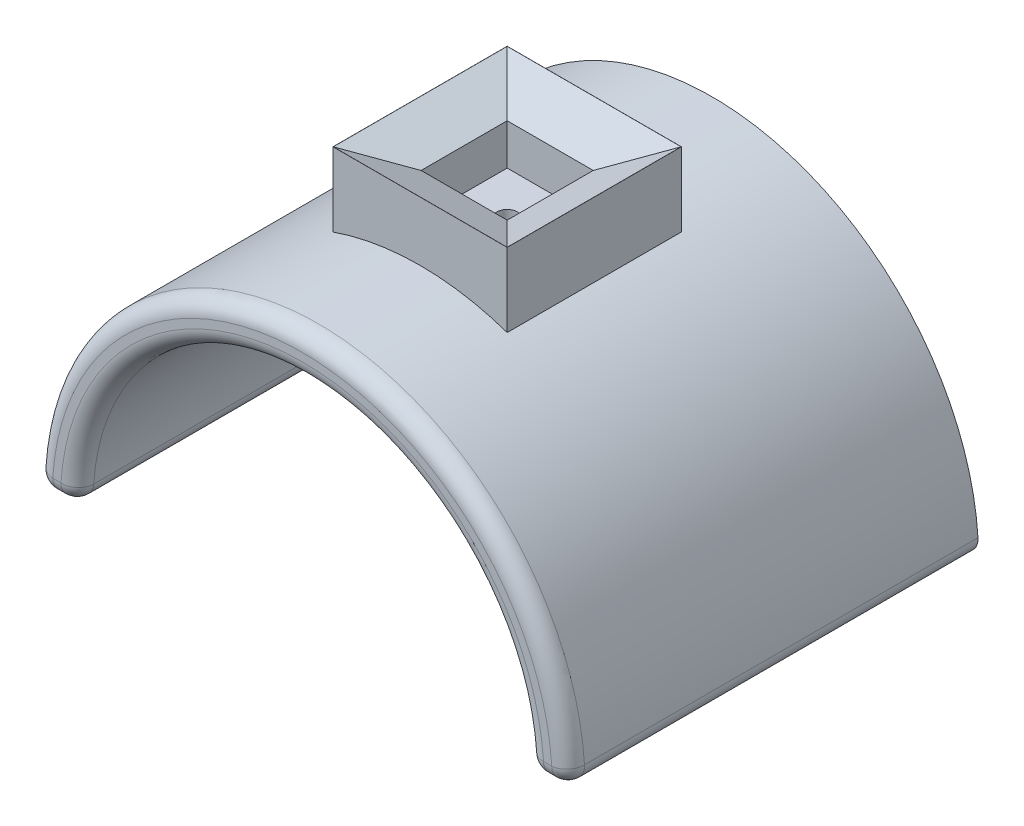
from build123d import *
from OCP.BRepFilletAPI import BRepFilletAPI_MakeChamfer

# Parameters (mm, degrees)
BOSS_EXTRUDE1_DEPTH = 50
BOSS_EXTRUDE2_DEPTH = 21.25
FILLET1_R           = 4
FILLET2_R           = 4
SKETCH3_W           = 21
SKETCH3_H           = 21
CUT_EXTRUDE1_DEPTH  = 15
CHAMFER1_SIZE       = 5
CHAMFER1_SIZE2      = 10.722534603
SKETCH4_R           = 2.5
CUT_EXTRUDE2_DEPTH  = 105.206319677
CUT_EXTRUDE3_START  = -5
SKETCH5_R           = 5
CUT_EXTRUDE3_DEPTH  = 100.206319725


with BuildPart() as part:
    # Sketch1 → Boss-Extrude1 (new, symmetric)
    with BuildSketch(Plane.XY):
        with BuildLine():
            Line((-65, 0), (-55, 0))
            ThreePointArc((-55, 0), (0, 55), (55, 0))
            Line((55, 0), (65, 0))
            ThreePointArc((65, 0), (0, 65), (-65, 0))
        make_face()
    extrude(amount=BOSS_EXTRUDE1_DEPTH, both=True)

    # Sketch2 → Boss-Extrude2 (add, symmetric)
    with BuildSketch(Plane.XY):
        with BuildLine():
            Line((-21.25, 61.428311877), (-21.25, 79.428311877))
            Line((-21.25, 79.428311877), (21.25, 79.428311877))
            Line((21.25, 79.428311877), (21.25, 61.428311877))
            ThreePointArc((21.25, 61.428311877), (0, 65), (-21.25, 61.428311877))
        make_face()
    extrude(amount=BOSS_EXTRUDE2_DEPTH, both=True)

    # Fillet1
    fillet1_edges = [part.edges().sort_by_distance(p)[0] for p in [
        (-55, 0, 0),
        (-65, 0, 0),
        (65, 0, 0),
        (55, 0, 0),
    ]]
    fillet(fillet1_edges, radius=FILLET1_R)

    # Fillet2
    fillet2_edges = [part.edges().sort_by_distance(p)[0] for p in [
        (0, 65, 50),
        (59.866480893, 0, 50),
        (0, 55, 50),
        (-59.866480893, 0, 50),
        (-63.788401254, 1.265880428, 50),
        (-56.133384976, 1.077266197, 50),
        (56.133384976, 1.077266197, 50),
        (63.788401254, 1.265880428, 50),
    ]]
    fillet(fillet2_edges, radius=FILLET2_R)

    # Sketch3 → Cut-Extrude1 (cut)
    with BuildSketch(Plane(origin=(0, 79.428311877, 0), x_dir=(1, 0, 0), z_dir=(0, 1, 0))):
        Rectangle(SKETCH3_W, SKETCH3_H)
    extrude(amount=-CUT_EXTRUDE1_DEPTH, mode=Mode.SUBTRACT)

    # Chamfer1: one chamfer whose edges measure the first distance from different faces: ONE call of the kernel's chamfer builder (chamfer() names one face for all edges)
    chamfer1_edges_1 = [part.edges().sort_by_distance(p)[0] for p in [
        (10.5, 79.428311877, 0),
    ]]
    chamfer1_side_1 = [part.faces().sort_by_distance(p)[0] for p in [
        (10.5, 71.928311877, 0),
    ]]
    chamfer1_edges_2 = [part.edges().sort_by_distance(p)[0] for p in [
        (0, 79.428311877, -10.5),
    ]]
    chamfer1_side_2 = [part.faces().sort_by_distance(p)[0] for p in [
        (0, 71.928311877, -10.5),
    ]]
    chamfer1_edges_3 = [part.edges().sort_by_distance(p)[0] for p in [
        (-10.5, 79.428311877, 0),
    ]]
    chamfer1_side_3 = [part.faces().sort_by_distance(p)[0] for p in [
        (-10.5, 71.928311877, 0),
    ]]
    chamfer1_edges_4 = [part.edges().sort_by_distance(p)[0] for p in [
        (0, 79.428311877, 10.5),
    ]]
    chamfer1_side_4 = [part.faces().sort_by_distance(p)[0] for p in [
        (0, 71.928311877, 10.5),
    ]]
    chamfer1 = BRepFilletAPI_MakeChamfer(part.part.solid().wrapped)
    for e in chamfer1_edges_1:
        chamfer1.Add(CHAMFER1_SIZE, CHAMFER1_SIZE2, e.wrapped, chamfer1_side_1[0].wrapped)  # the first distance lies on this face
    for e in chamfer1_edges_2:
        chamfer1.Add(CHAMFER1_SIZE, CHAMFER1_SIZE2, e.wrapped, chamfer1_side_2[0].wrapped)  # the first distance lies on this face
    for e in chamfer1_edges_3:
        chamfer1.Add(CHAMFER1_SIZE, CHAMFER1_SIZE2, e.wrapped, chamfer1_side_3[0].wrapped)  # the first distance lies on this face
    for e in chamfer1_edges_4:
        chamfer1.Add(CHAMFER1_SIZE, CHAMFER1_SIZE2, e.wrapped, chamfer1_side_4[0].wrapped)  # the first distance lies on this face
    add(Compound.cast(chamfer1.Shape()), mode=Mode.REPLACE)

    # Sketch4 → Cut-Extrude2 (cut, through all)
    with BuildSketch(Plane(origin=(0, 64.428311877, 0), x_dir=(1, 0, 0), z_dir=(0, 1, 0))):
        with Locations(Location((0, 0, 0), (0, 0, 270))):
            Circle(SKETCH4_R)
    extrude(amount=-CUT_EXTRUDE2_DEPTH, mode=Mode.SUBTRACT)

    # Sketch5 → Cut-Extrude3 (cut, through all)
    with BuildSketch(Plane(origin=(0, 64.428311877, 0), x_dir=(1, 0, 0), z_dir=(0, 1, 0)).offset(CUT_EXTRUDE3_START)):
        with Locations(Location((0, 0, 0), (0, 0, 270))):
            Circle(SKETCH5_R)
    extrude(amount=-CUT_EXTRUDE3_DEPTH, mode=Mode.SUBTRACT)


solid = part.part
